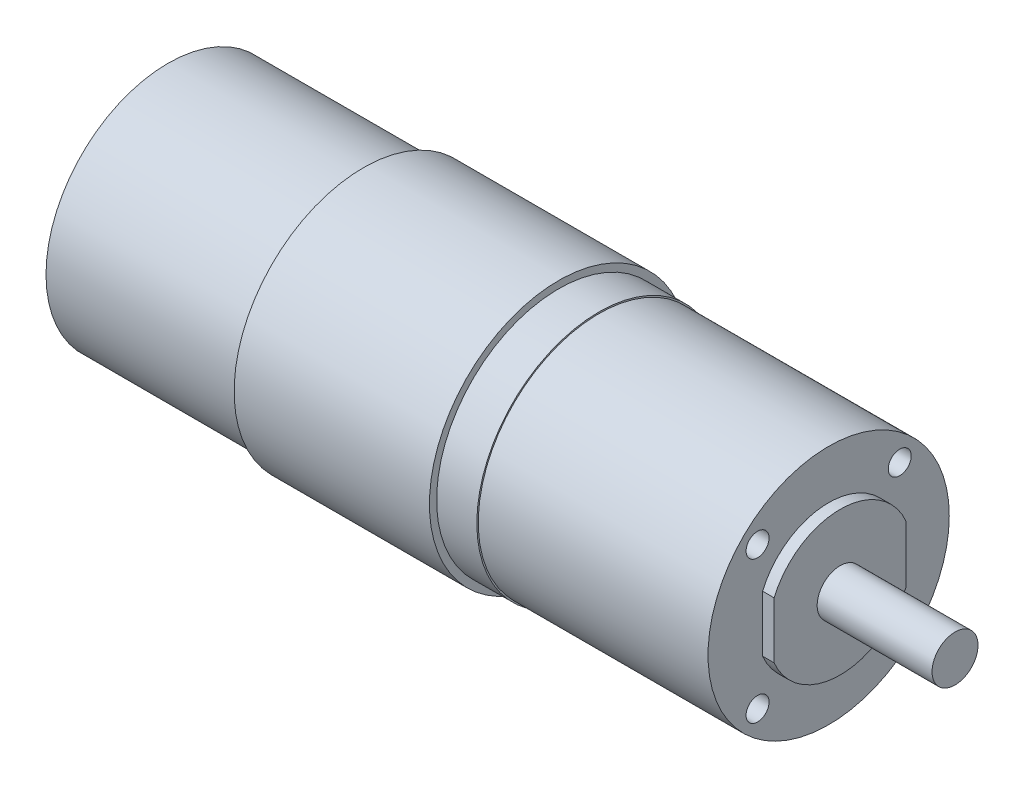
from build123d import *

# Parameters (mm, degrees)
SKETCH1_R           = 21
BOSS_EXTRUDE1_DEPTH = 40
BOSS_EXTRUDE2_DEPTH = 2
SKETCH3_R           = 4
BOSS_EXTRUDE3_DEPTH = 20
SKETCH4_R           = 2
CUT_EXTRUDE1_DEPTH  = 10
SKETCH5_R           = 21.25
BOSS_EXTRUDE4_DEPTH = 75
SKETCH6_R           = 22.5
SKETCH6_R_2         = 21.25
BOSS_EXTRUDE5_DEPTH = 34


with BuildPart() as part:
    # Sketch1 → Boss-Extrude1 (new body)
    with BuildSketch(Plane(origin=(0, 0, 0), x_dir=(0, 0, -1), z_dir=(1, 0, 0))):
        Circle(SKETCH1_R)
    extrude(amount=BOSS_EXTRUDE1_DEPTH)

    # Sketch2 → Boss-Extrude2 (add)
    with BuildSketch(Plane(origin=(40, 0, 0), x_dir=(0, 0, -1), z_dir=(1, 0, 0))):
        with BuildLine():
            Line((-11.5, 4.898979486), (-11.5, -4.898979486))
            ThreePointArc((-11.5, -4.898979486), (0, -12.5), (11.5, -4.898979486))
            Line((11.5, -4.898979486), (11.5, 4.898979486))
            ThreePointArc((11.5, 4.898979486), (0, 12.5), (-11.5, 4.898979486))
        make_face()
    extrude(amount=BOSS_EXTRUDE2_DEPTH)

    # Sketch3 → Boss-Extrude3 (add)
    with BuildSketch(Plane(origin=(42, 0, 0), x_dir=(0, 0, -1), z_dir=(1, 0, 0))):
        Circle(SKETCH3_R)
    extrude(amount=BOSS_EXTRUDE3_DEPTH)

    # Sketch4 → Cut-Extrude1 (cut)
    with BuildSketch(Plane(origin=(40, 0, 0), x_dir=(0, 0, -1), z_dir=(1, 0, 0))):
        with Locations((-12.374368671, 12.374368671)):
            Circle(SKETCH4_R)
        with Locations((12.374368671, 12.374368671)):
            Circle(SKETCH4_R)
        with Locations((12.374368671, -12.374368671)):
            Circle(SKETCH4_R)
        with Locations((-12.374368671, -12.374368671)):
            Circle(SKETCH4_R)
    extrude(amount=-CUT_EXTRUDE1_DEPTH, mode=Mode.SUBTRACT)

    # Sketch5 → Boss-Extrude4 (add)
    with BuildSketch(Plane.ZY):
        Circle(SKETCH5_R)
    extrude(amount=BOSS_EXTRUDE4_DEPTH)

    # Sketch6 → Boss-Extrude5 (add)
    with BuildSketch(Plane(origin=(-7, 0, 0), x_dir=(0, 0, -1), z_dir=(1, 0, 0))):
        Circle(SKETCH6_R)
        Circle(SKETCH6_R_2, mode=Mode.SUBTRACT)
    extrude(amount=-BOSS_EXTRUDE5_DEPTH)


solid = part.part
